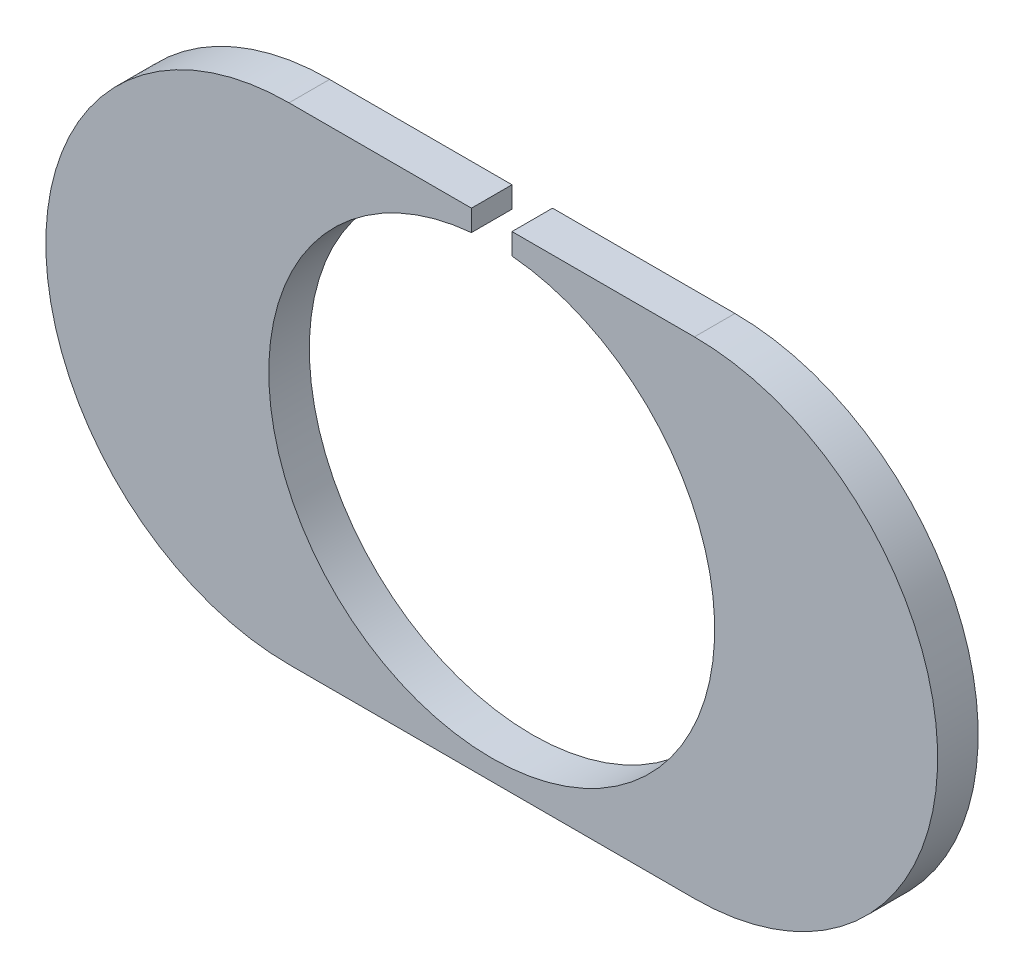
from build123d import *

# Parameters (mm, degrees)
SKETCH2_R           = 55
BOSS_EXTRUDE1_DEPTH = 10
CUT_EXTRUDE1_REACH  = 127.698
SKETCH4_W           = 10
SKETCH4_H           = 5.227744249


with BuildPart() as part:
    # Sketch2 → Boss-Extrude1 (new body)
    with BuildSketch(Plane.XY):
        with BuildLine():
            Line((-50, 60), (50, 60))
            ThreePointArc((50, 60), (110, 0), (50, -60))
            Line((50, -60), (-50, -60))
            ThreePointArc((-50, -60), (-110, 0), (-50, 60))
        make_face()
        Circle(SKETCH2_R, mode=Mode.SUBTRACT)
    extrude(amount=BOSS_EXTRUDE1_DEPTH)

    # Sketch4 → Cut-Extrude1 (cut, up to next)
    with BuildSketch(Plane.XY.offset(10), mode=Mode.PRIVATE) as cut_extrude1_sk1:
        with Locations((0, 57.386127876)):
            Rectangle(SKETCH4_W, SKETCH4_H)
    cut_extrude1_tool1 = extrude(cut_extrude1_sk1.sketch, amount=-CUT_EXTRUDE1_REACH, mode=Mode.PRIVATE) & part.part
    add(cut_extrude1_tool1.solids().sort_by_distance((0, 57.386128, 10))[0], mode=Mode.SUBTRACT)


solid = part.part
